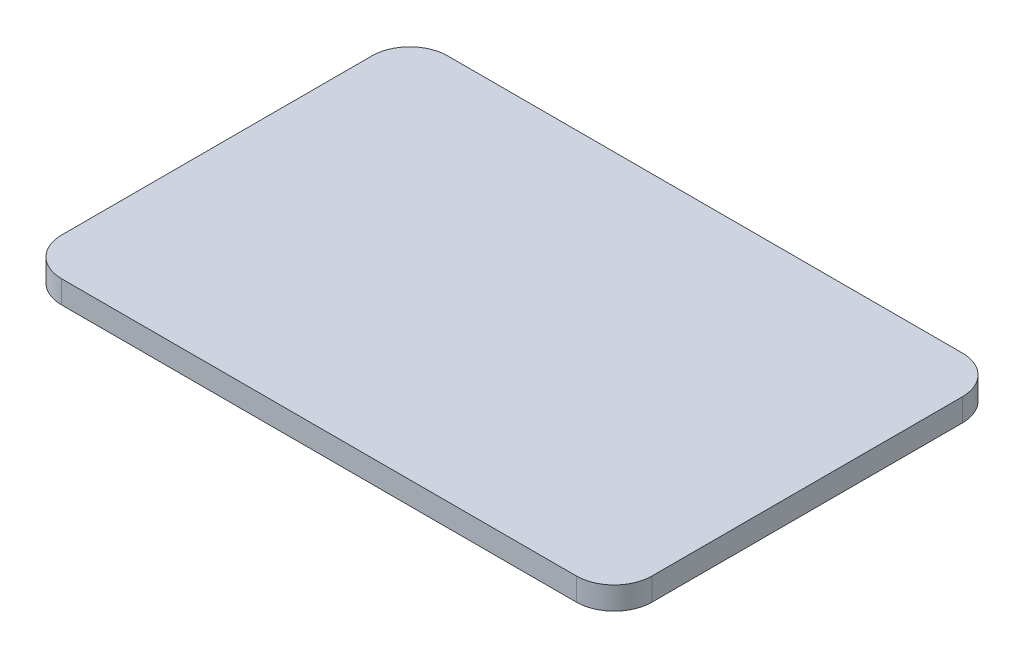
from build123d import *

# Parameters (mm, degrees)
SKETCH1_W           = 78
SKETCH1_H           = 51
BOSS_EXTRUDE1_DEPTH = 3
FILLET1_R           = 5


with BuildPart() as part:
    # Sketch1 → Boss-Extrude1 (new body)
    with BuildSketch(Plane(origin=(0, 0, 0), x_dir=(1, 0, 0), z_dir=(0, 1, 0))):
        Rectangle(SKETCH1_W, SKETCH1_H)
    extrude(amount=BOSS_EXTRUDE1_DEPTH)

    # Fillet1
    fillet1_edges = [part.edges().sort_by_distance(p)[0] for p in [
        (39, 1.5, 25.5),
        (-39, 1.5, 25.5),
        (-39, 1.5, -25.5),
        (39, 1.5, -25.5),
    ]]
    fillet(fillet1_edges, radius=FILLET1_R)


solid = part.part
